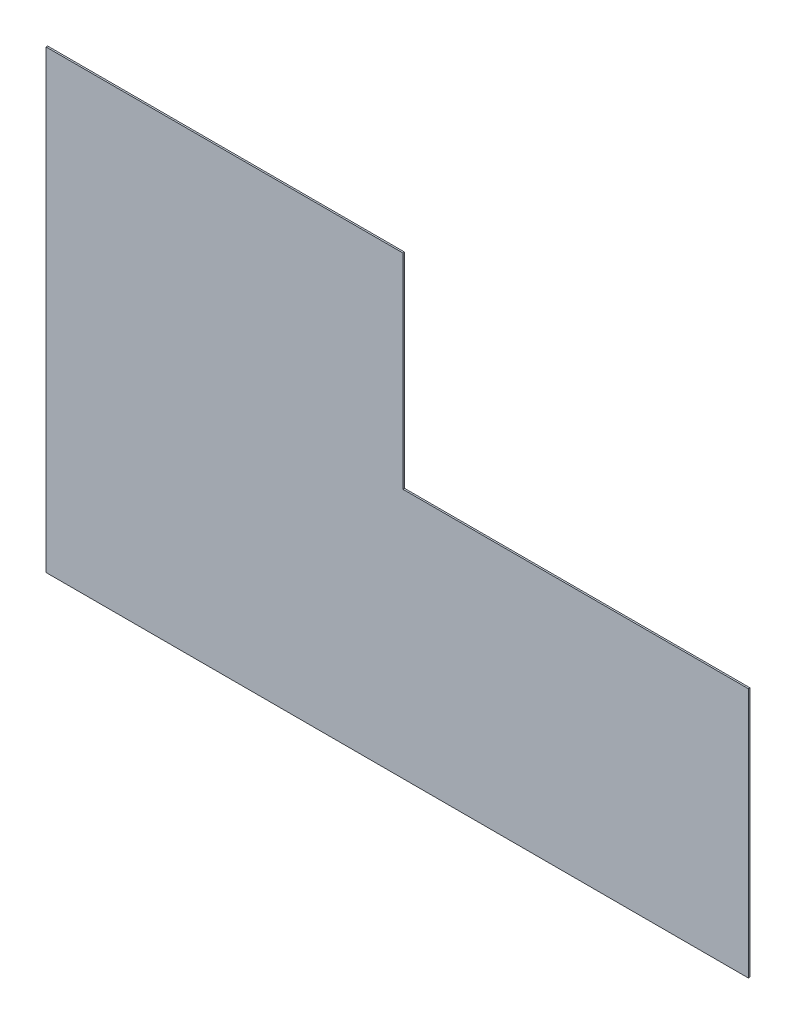
from build123d import *

# Parameters (mm, degrees)
BOSS_EXTRUDE1_DEPTH = 1.5875


with BuildPart() as part:
    # Sketch1 → Boss-Extrude1 (new body)
    with BuildSketch(Plane.XY):
        Polygon((0, 244.6657), (-337.206993923, 244.6657), (-337.206993923, 444.5), (-685.8, 444.5), (-685.8, 0), (0, 0), align=None)
    extrude(amount=BOSS_EXTRUDE1_DEPTH)


solid = part.part
